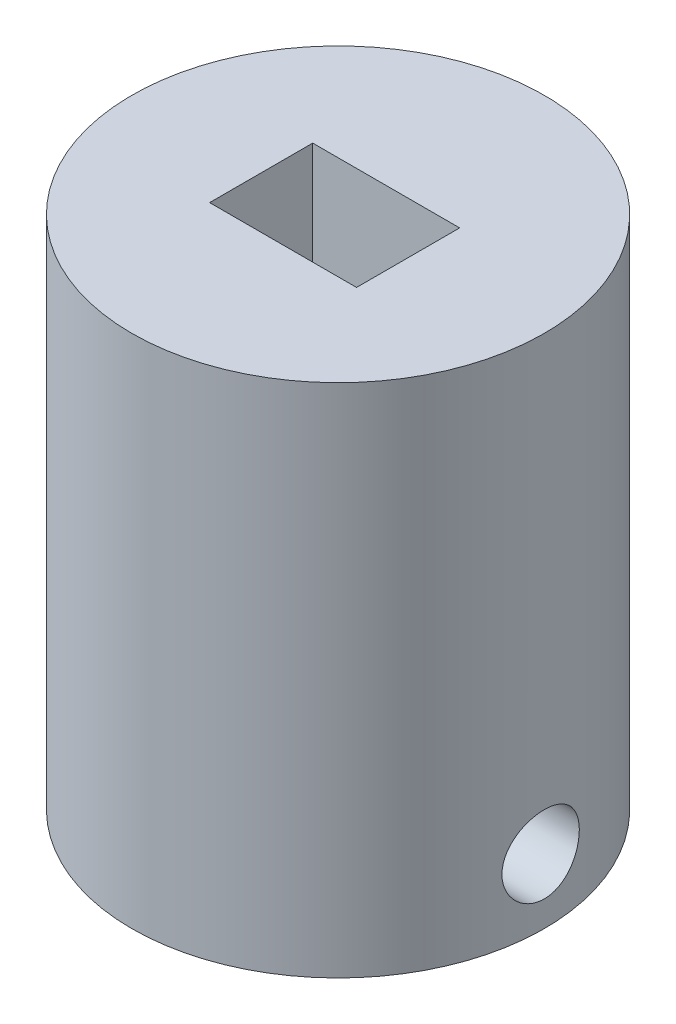
from build123d import *

# Parameters (mm, degrees)
SKETCH3_R               = 8
BOSS_EXTRUDE1_DEPTH     = 20
SKETCH4_R               = 4
CUT_EXTRUDE1_DEPTH      = 12
CUT_EXTRUDE2_DEPTH      = 23.978250586
CUT_EXTRUDE2_DEPTH_BACK = 23.978250586
SKETCH5_R               = 1.5
SKETCH6_W               = 5.7
SKETCH6_H               = 4
CUT_EXTRUDE3_DEPTH      = 6


with BuildPart() as part:
    # Sketch3 → Boss-Extrude1 (new body)
    with BuildSketch(Plane(origin=(0, 0, 0), x_dir=(1, 0, 0), z_dir=(0, 1, 0))):
        with Locations(Location((0, 0, 0), (0, 0, 270))):
            Circle(SKETCH3_R)
    extrude(amount=BOSS_EXTRUDE1_DEPTH)

    # Sketch4 → Cut-Extrude1 (cut)
    with BuildSketch(Plane.XZ):
        with Locations(Location((0, 0, 0), (0, 0, 270))):
            Circle(SKETCH4_R)
    extrude(amount=-CUT_EXTRUDE1_DEPTH, mode=Mode.SUBTRACT)

    # Sketch5 → Cut-Extrude2 (cut, two sides: drawn at the far end of the back side and taken through both)
    with BuildSketch(Plane(origin=(0, 0, 0), x_dir=(0, 0, -1), z_dir=(1, 0, 0)).offset(-CUT_EXTRUDE2_DEPTH_BACK)):
        with Locations((0, 2.5)):
            Circle(SKETCH5_R)
    extrude(amount=CUT_EXTRUDE2_DEPTH + CUT_EXTRUDE2_DEPTH_BACK, mode=Mode.SUBTRACT)

    # Sketch6 → Cut-Extrude3 (cut)
    with BuildSketch(Plane(origin=(0, 20, 0), x_dir=(1, 0, 0), z_dir=(0, 1, 0))):
        with Locations((-0.034439742, -0.098165146)):
            Rectangle(SKETCH6_W, SKETCH6_H)
    extrude(amount=-CUT_EXTRUDE3_DEPTH, mode=Mode.SUBTRACT)


solid = part.part
